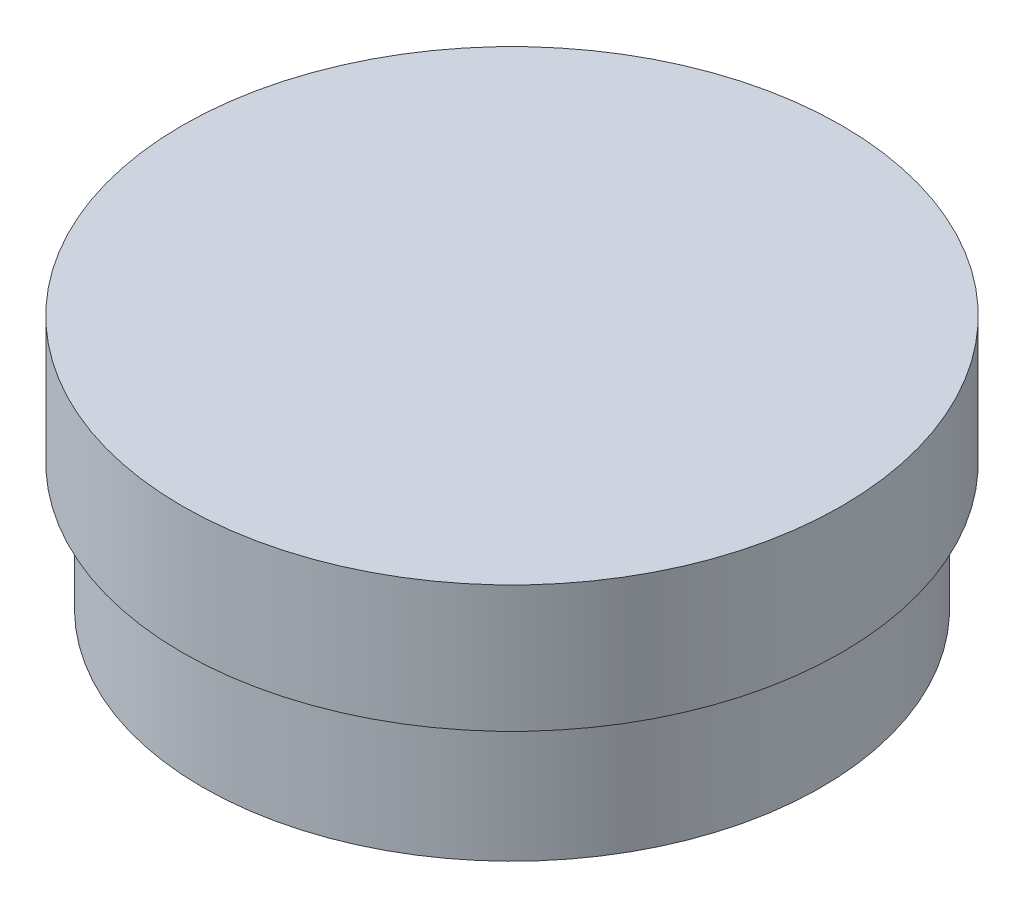
from build123d import *


with BuildPart() as part:
    # Sketch1 → Revolve1 (revolve)
    with BuildSketch(Plane.XY, mode=Mode.PRIVATE) as revolve1_sk:
        Polygon((0, 48.053571429), (65, 48.053571429), (65, 23.053571429), (61, 23.053571429), (61, -1.946428571), (0, -1.946428571), align=None)
    revolve(revolve1_sk.sketch.rotate(Axis((0, 53.160714286, 0), (0, -1, 0)), 90), axis=Axis((0, 53.160714286, 0), (0, -1, 0)))


solid = part.part
